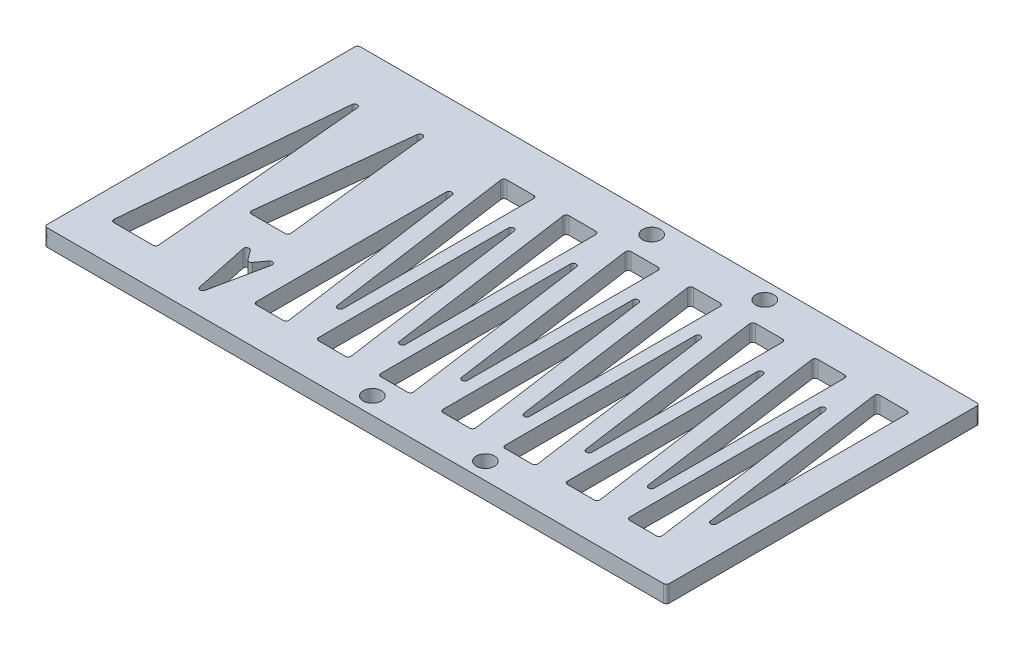
from build123d import *

# Parameters (mm, degrees)
EXTRUDE_1_DEPTH     = 3
SKETCH_2_R          = 1.6
CUT_EXTRUDE_1_DEPTH = 62.654602424
CUT_EXTRUDE_2_DEPTH = 62.654602424
CUT_EXTRUDE_3_DEPTH = 62.654602424
FILLET_2_R          = 0.5


with BuildPart() as part:
    # 草图1 → 凸台-拉伸1 (new body)
    with BuildSketch(Plane(origin=(0, 0, 0), x_dir=(1, 0, 0), z_dir=(0, 1, 0))):
        Polygon((-55, 27.7), (-43.5, 27.7), (-33.5, 27.7), (33.5, 27.7), (43.5, 27.7), (55, 27.7), (55, -27.7), (43.5, -27.7), (33.5, -27.7), (-33.5, -27.7), (-43.5, -27.7), (-55, -27.7), align=None)
    extrude(amount=EXTRUDE_1_DEPTH)

    # 草图2 → 切除-拉伸1 (cut, through all)
    with BuildSketch(Plane(origin=(0, 3, 0), x_dir=(1, 0, 0), z_dir=(0, 1, 0))):
        with Locations(Location((0, 24.7, 0), (0, 0, 270))):
            Circle(SKETCH_2_R)
        with Locations(Location((20, 24.7, 0), (0, 0, 270))):
            Circle(SKETCH_2_R)
        with Locations(Location((20, -24.7, 0), (0, 0, 90))):
            Circle(SKETCH_2_R)
        with Locations(Location((0, -24.7, 0), (0, 0, 90))):
            Circle(SKETCH_2_R)
    extrude(amount=-CUT_EXTRUDE_1_DEPTH, mode=Mode.SUBTRACT)

    # 草图4 → 切除-拉伸2 (cut, through all)
    with BuildSketch(Plane.XZ):
        Polygon((-31.443462795, 25.668589291), (-34.443462795, 11.332567733), (-31.443462795, 15.419941133), (-28.443462795, 11.332567733), align=None)
    extrude(amount=-CUT_EXTRUDE_2_DEPTH, mode=Mode.SUBTRACT)

    # 草图5 → 切除-拉伸3 (cut, through all)
    with BuildSketch(Plane.XZ):
        Polygon((-49.924888237, 21.024053863), (-41.932272719, 21.024053863), (-45.928580478, -23.688259036), align=None)
        Polygon((-39.084223489, 7.546349568), (-32.023477439, 7.546349568), (-35.553850464, -23.688259036), align=None)
        Polygon((-24.685839388, 21.024053863), (-18.871107346, 21.024053863), (-24.685839388, -20.142850627), align=None)
        Polygon((-15.944927595, 21.024053863), (-21.778473367, -20.276047316), (-15.944927595, -20.276047316), align=None)
        Polygon((-13.685839388, -20.142850627), (-13.685839388, 21.024053863), (-7.871107346, 21.024053863), align=None)
        Polygon((-4.944927595, -20.276047316), (-4.944927595, 21.024053863), (-10.778473367, -20.276047316), align=None)
        Polygon((-2.685839388, -20.142850627), (-2.685839388, 21.024053863), (3.128892654, 21.024053863), align=None)
        Polygon((6.055072405, -20.276047316), (6.055072405, 21.024053863), (0.221526633, -20.276047316), align=None)
        Polygon((8.314160612, -20.142850627), (8.314160612, 21.024053863), (14.128892654, 21.024053863), align=None)
        Polygon((17.055072405, -20.276047316), (17.055072405, 21.024053863), (11.221526633, -20.276047316), align=None)
        Polygon((19.314160612, -20.142850627), (19.314160612, 21.024053863), (25.128892654, 21.024053863), align=None)
        Polygon((28.055072405, -20.276047316), (28.055072405, 21.024053863), (22.221526633, -20.276047316), align=None)
        Polygon((30.314160612, -20.142850627), (30.314160612, 21.024053863), (36.128892654, 21.024053863), align=None)
        Polygon((39.055072405, -20.276047316), (39.055072405, 21.024053863), (33.221526633, -20.276047316), align=None)
        Polygon((41.314160612, -20.142850627), (41.314160612, 21.024053863), (47.128892654, 21.024053863), align=None)
        Polygon((50.055072405, -20.276047316), (50.055072405, 21.024053863), (44.221526633, -20.276047316), align=None)
    extrude(amount=-CUT_EXTRUDE_3_DEPTH, mode=Mode.SUBTRACT)

    # 圆角2
    fillet_2_edges = [part.edges().sort_by_distance(p)[0] for p in [
        (-45.928580478, 1.5, -23.688259036),
        (-49.924888237, 1.5, 21.024053863),
        (-41.932272719, 1.5, 21.024053863),
        (30.314160612, 1.5, 21.024053863),
        (36.128892654, 1.5, 21.024053863),
        (30.314160612, 1.5, -20.142850627),
        (22.221526633, 1.5, -20.276047316),
        (28.055072405, 1.5, 21.024053863),
        (28.055072405, 1.5, -20.276047316),
        (19.314160612, 1.5, 21.024053863),
        (25.128892654, 1.5, 21.024053863),
        (19.314160612, 1.5, -20.142850627),
        (11.221526633, 1.5, -20.276047316),
        (17.055072405, 1.5, 21.024053863),
        (17.055072405, 1.5, -20.276047316),
        (44.221526633, 1.5, -20.276047316),
        (50.055072405, 1.5, 21.024053863),
        (50.055072405, 1.5, -20.276047316),
        (41.314160612, 1.5, 21.024053863),
        (47.128892654, 1.5, 21.024053863),
        (41.314160612, 1.5, -20.142850627),
        (33.221526633, 1.5, -20.276047316),
        (39.055072405, 1.5, 21.024053863),
        (39.055072405, 1.5, -20.276047316),
        (-13.685839388, 1.5, 21.024053863),
        (-7.871107346, 1.5, 21.024053863),
        (-13.685839388, 1.5, -20.142850627),
        (-15.944927595, 1.5, 21.024053863),
        (-15.944927595, 1.5, -20.276047316),
        (-21.778473367, 1.5, -20.276047316),
        (-24.685839388, 1.5, -20.142850627),
        (-24.685839388, 1.5, 21.024053863),
        (-18.871107346, 1.5, 21.024053863),
        (-35.553850464, 1.5, -23.688259036),
        (-39.084223489, 1.5, 7.546349568),
        (-32.023477439, 1.5, 7.546349568),
        (8.314160612, 1.5, 21.024053863),
        (14.128892654, 1.5, 21.024053863),
        (8.314160612, 1.5, -20.142850627),
        (0.221526633, 1.5, -20.276047316),
        (6.055072405, 1.5, 21.024053863),
        (6.055072405, 1.5, -20.276047316),
        (-2.685839388, 1.5, 21.024053863),
        (3.128892654, 1.5, 21.024053863),
        (-2.685839388, 1.5, -20.142850627),
        (-10.778473367, 1.5, -20.276047316),
        (-4.944927595, 1.5, 21.024053863),
        (-4.944927595, 1.5, -20.276047316),
        (-55, 1.5, 27.7),
        (-55, 1.5, -27.7),
        (55, 1.5, -27.7),
        (55, 1.5, 27.7),
        (-31.443462795, 1.5, 25.668589291),
        (-28.443462795, 1.5, 11.332567733),
        (-31.443462795, 1.5, 15.419941133),
        (-34.443462795, 1.5, 11.332567733),
    ]]
    fillet(fillet_2_edges, radius=FILLET_2_R)


solid = part.part
